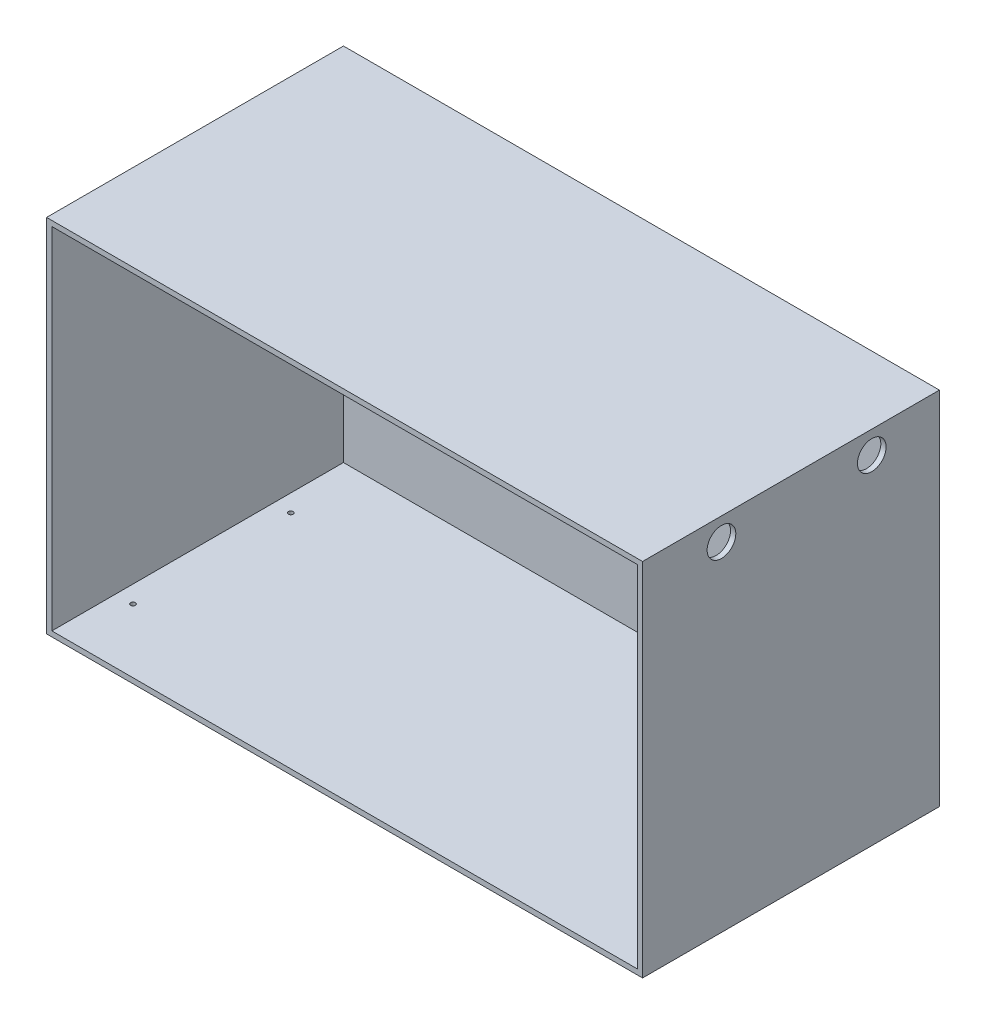
from build123d import *

# Parameters (mm, degrees)
CROQUIS1_W              = 793
CROQUIS1_H              = 440
SALIENTE_EXTRUIR1_DEPTH = 480
VACIADO1_T              = -7
CROQUIS2_R              = 12.7
CORTAR_EXTRUIR1_DEPTH   = 80
CROQUIS3_R              = 6.35
CORTAR_EXTRUIR2_DEPTH   = 10
CROQUIS5_R              = 6.35
CORTAR_EXTRUIR4_DEPTH   = 10
CROQUIS6_R              = 19.05
CORTAR_EXTRUIR5_DEPTH   = 848
CROQUIS8_R              = 12.7
CORTAR_EXTRUIR6_DEPTH   = 10
CROQUIS9_W              = 35.052267511
CROQUIS9_H              = 245.374735938
SALIENTE_EXTRUIR2_DEPTH = 7
CROQUIS15_R             = 3.175
CORTAR_EXTRUIR10_DEPTH  = 10
CROQUIS18_R             = 3.175
CROQUIS18_R_2           = 5.554937391
CORTAR_EXTRUIR12_DEPTH  = 10
CROQUIS19_W             = 793
CROQUIS19_H             = 480
CORTAR_EXTRUIR13_DEPTH  = 45
CROQUIS20_W             = 40.222844752
CROQUIS20_H             = 335.190372933
SALIENTE_EXTRUIR3_DEPTH = 7
CROQUIS22_W             = 754.715939893
CROQUIS22_H             = 447.32434432
SALIENTE_EXTRUIR4_DEPTH = 7


with BuildPart() as part:
    # Croquis1 → Saliente-Extruir1 (new body)
    with BuildSketch(Plane(origin=(0, 0, 0), x_dir=(1, 0, 0), z_dir=(0, 1, 0))):
        Rectangle(CROQUIS1_W, CROQUIS1_H)
    extrude(amount=SALIENTE_EXTRUIR1_DEPTH)

    # Vaciado1
    vaciado1_openings = [part.faces().sort_by_distance(p)[0] for p in [
        (0, 240, 220),
    ]]
    offset(amount=VACIADO1_T, openings=vaciado1_openings, kind=Kind.INTERSECTION)

    # Croquis2 → Cortar-Extruir1 (cut)
    with BuildSketch(Plane.XZ):
        with Locations(Location((-340.681431581, 41.288678468, 0), (0, 0, 270))):
            Circle(CROQUIS2_R)
    cortar_extruir1 = extrude(amount=-CORTAR_EXTRUIR1_DEPTH, mode=Mode.SUBTRACT)

    # Croquis3 → Cortar-Extruir2 (cut)
    with BuildSketch(Plane.XZ):
        with Locations(Location((-340.681431581, 81.288678468, 0), (0, 0, 270))):
            Circle(CROQUIS3_R)
    cortar_extruir2 = extrude(amount=-CORTAR_EXTRUIR2_DEPTH, mode=Mode.SUBTRACT)

    # Croquis5 → Cortar-Extruir4 (cut)
    with BuildSketch(Plane.XZ):
        with Locations(Location((-340.681431581, 121.288678468, 0), (0, 0, 270))):
            Circle(CROQUIS5_R)
    cortar_extruir4 = extrude(amount=-CORTAR_EXTRUIR4_DEPTH, mode=Mode.SUBTRACT)

    # Croquis6 → Cortar-Extruir5 (cut)
    with BuildSketch(Plane.ZY.offset(396.5)):
        with Locations((-130, 450)):
            Circle(CROQUIS6_R)
        with Locations((70, 450)):
            Circle(CROQUIS6_R)
    extrude(amount=-CORTAR_EXTRUIR5_DEPTH, mode=Mode.SUBTRACT)

    # Simetría1: Cortar-Extruir1, Cortar-Extruir2, Cortar-Extruir4 across plane
    add(cortar_extruir1.mirror(Plane(origin=(0, 0, 0), x_dir=(0, 0, 1), z_dir=(1, 0, 0))), mode=Mode.SUBTRACT)
    add(cortar_extruir2.mirror(Plane(origin=(0, 0, 0), x_dir=(0, 0, 1), z_dir=(1, 0, 0))), mode=Mode.SUBTRACT)
    add(cortar_extruir4.mirror(Plane(origin=(0, 0, 0), x_dir=(0, 0, 1), z_dir=(1, 0, 0))), mode=Mode.SUBTRACT)

    # Croquis8 → Cortar-Extruir6 (cut)
    with BuildSketch(Plane.XZ):
        with Locations(Location((340.681431581, -121.411321532, 0), (0, 0, 270))):
            Circle(CROQUIS8_R)
    extrude(amount=-CORTAR_EXTRUIR6_DEPTH, mode=Mode.SUBTRACT)

    # Croquis9 → Saliente-Extruir2 (add)
    with BuildSketch(Plane(origin=(0, 7, 0), x_dir=(1, 0, 0), z_dir=(0, 1, 0))):
        with Locations((-340.681431581, -81.288678468)):
            Rectangle(CROQUIS9_W, CROQUIS9_H)
    extrude(amount=-SALIENTE_EXTRUIR2_DEPTH)

    # Croquis15 → Cortar-Extruir10 (cut)
    with BuildSketch(Plane.XZ):
        with Locations(Location((-366.5, -120, 0), (0, 0, 270))):
            Circle(CROQUIS15_R)
        with Locations(Location((-366.5, 90, 0), (0, 0, 90))):
            Circle(CROQUIS15_R)
        with Locations(Location((366.5, -120, 0), (0, 0, 90))):
            Circle(CROQUIS15_R)
        with Locations(Location((366.5, 90, 0), (0, 0, 270))):
            Circle(CROQUIS15_R)
    extrude(amount=-CORTAR_EXTRUIR10_DEPTH, mode=Mode.SUBTRACT)

    # Croquis18 → Cortar-Extruir12 (cut)
    with BuildSketch(Plane.XY.offset(-213)):
        with Locations((-348, 438)):
            Circle(CROQUIS18_R)
        with Locations((0, 438)):
            Circle(CROQUIS18_R)
        with Locations((348, 438)):
            Circle(CROQUIS18_R)
        with Locations((348, 240)):
            Circle(CROQUIS18_R)
        with Locations((348, 42)):
            Circle(CROQUIS18_R)
        with Locations((0, 42)):
            Circle(CROQUIS18_R)
        with Locations((-348, 42)):
            Circle(CROQUIS18_R)
        with Locations((-348, 240)):
            Circle(CROQUIS18_R_2)
    extrude(amount=-CORTAR_EXTRUIR12_DEPTH, mode=Mode.SUBTRACT)

    # Croquis19 → Cortar-Extruir13 (cut)
    with BuildSketch(Plane.XY.offset(220)):
        with Locations((0, 240)):
            Rectangle(CROQUIS19_W, CROQUIS19_H)
    extrude(amount=-CORTAR_EXTRUIR13_DEPTH, mode=Mode.SUBTRACT)

    # Croquis20 → Saliente-Extruir3 (add)
    with BuildSketch(Plane.XZ):
        with Locations((336.531134424, -29.98561058)):
            Rectangle(CROQUIS20_W, CROQUIS20_H)
    extrude(amount=-SALIENTE_EXTRUIR3_DEPTH)

    # Croquis22 → Saliente-Extruir4 (add)
    with BuildSketch(Plane(origin=(0, 0, -220), x_dir=(-1, 0, 0), z_dir=(0, 0, -1))):
        with Locations((2.077532213, 243.10690677)):
            Rectangle(CROQUIS22_W, CROQUIS22_H)
    extrude(amount=-SALIENTE_EXTRUIR4_DEPTH)


solid = part.part
